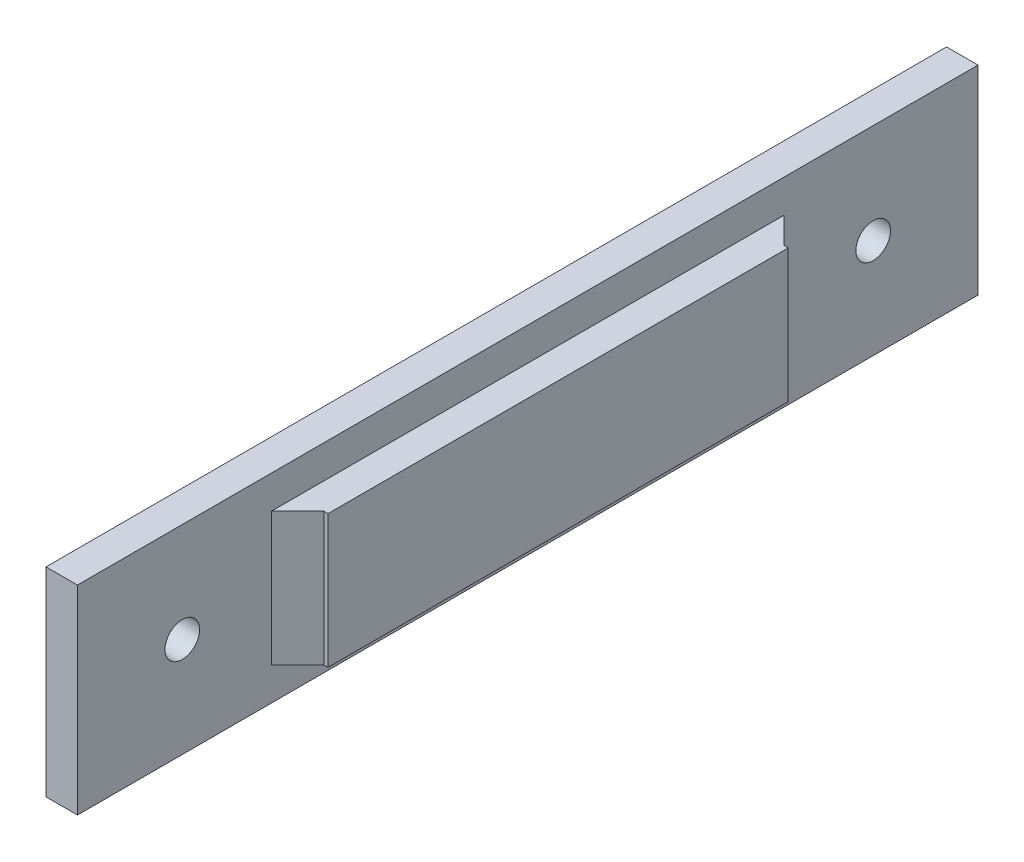
from build123d import *

# Parameters (mm, degrees)
SKETCH_1_W          = 19
SKETCH_1_H          = 19
SKETCH_1_W_2        = 13
SKETCH_1_H_2        = 13
EXTRUDE_1_DEPTH     = 85.9
SKETCH_2_R          = 1.65
CUT_EXTRUDE_1_DEPTH = 30
SKETCH_3_W          = 85.9
SKETCH_3_H          = 19
CUT_EXTRUDE_2_DEPTH = 16
SKETCH_4_W          = 43.9
SKETCH_4_H          = 12.7
EXTRUDE_1_2_DEPTH   = 2.9
CHAMFER_1_SIZE      = 2.5


with BuildPart() as part:
    # 草图1 → Extrude 1 (new body)
    with BuildSketch(Plane.XY):
        with Locations((6.5, 6.5)):
            Rectangle(SKETCH_1_W, SKETCH_1_H)
        with Locations((6.5, 6.5)):
            Rectangle(SKETCH_1_W_2, SKETCH_1_H_2, mode=Mode.SUBTRACT)
    extrude(amount=EXTRUDE_1_DEPTH)

    # 草图2 → 切除-拉伸1 (cut)
    with BuildSketch(Plane.ZY.offset(3)):
        with Locations((10, 6.5)):
            Circle(SKETCH_2_R)
        with Locations((75.9, 6.5)):
            Circle(SKETCH_2_R)
    extrude(amount=-CUT_EXTRUDE_1_DEPTH, mode=Mode.SUBTRACT)

    # 草图3 → 切除-拉伸2 (cut)
    with BuildSketch(Plane(origin=(16, 0, 0), x_dir=(0, 0, -1), z_dir=(1, 0, 0))):
        with Locations((-42.95, 6.5)):
            Rectangle(SKETCH_3_W, SKETCH_3_H)
    extrude(amount=-CUT_EXTRUDE_2_DEPTH, mode=Mode.SUBTRACT)

    # 草图4 → Extrude 1 2 (add)
    with BuildSketch(Plane(origin=(0, 0, 0), x_dir=(0, 0, -1), z_dir=(1, 0, 0))):
        with Locations((-42.95, 6.5)):
            Rectangle(SKETCH_4_W, SKETCH_4_H)
    extrude(amount=EXTRUDE_1_2_DEPTH)

    # 倒角1
    chamfer_1_edges = [part.edges().sort_by_distance(p)[0] for p in [
        (0, 6.5, 64.9),
        (0, 6.5, 21),
    ]]
    chamfer(chamfer_1_edges, length=CHAMFER_1_SIZE)


solid = part.part
